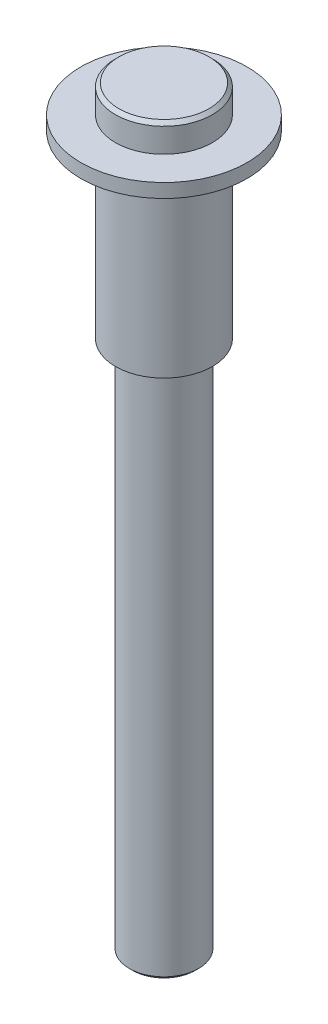
from build123d import *

# Parameters (mm, degrees)
SKETCH2_R           = 3.5
BOSS_EXTRUDE1_DEPTH = 16
CHAMFER1_SIZE       = 0.25
SKETCH3_R           = 2.5
BOSS_EXTRUDE2_DEPTH = 38.4
CHAMFER2_SIZE       = 0.25
SKETCH4_R           = 6
BOSS_EXTRUDE3_DEPTH = 1


with BuildPart() as part:
    # Sketch2 → Boss-Extrude1 (new body)
    with BuildSketch(Plane(origin=(0, 0, 0), x_dir=(1, 0, 0), z_dir=(0, 1, 0))):
        with Locations(Location((0, 0, 0), (0, 0, 270))):
            Circle(SKETCH2_R)
    extrude(amount=BOSS_EXTRUDE1_DEPTH)

    # Chamfer1
    chamfer1_edges = [part.edges().sort_by_distance(p)[0] for p in [
        (0, 16, -3.5),
    ]]
    chamfer(chamfer1_edges, length=CHAMFER1_SIZE)

    # Sketch3 → Boss-Extrude2 (add)
    with BuildSketch(Plane.XZ):
        with Locations(Location((0, 0, 0), (0, 0, 90))):
            Circle(SKETCH3_R)
    extrude(amount=BOSS_EXTRUDE2_DEPTH)

    # Chamfer2
    chamfer2_edges = [part.edges().sort_by_distance(p)[0] for p in [
        (0, -38.4, -2.5),
    ]]
    chamfer(chamfer2_edges, length=CHAMFER2_SIZE)

    # Sketch4 → Boss-Extrude3 (add)
    with BuildSketch(Plane(origin=(0, 14, 0), x_dir=(1, 0, 0), z_dir=(0, 1, 0))):
        with Locations(Location((0, 0, 0), (0, 0, 270))):
            Circle(SKETCH4_R)
    extrude(amount=-BOSS_EXTRUDE3_DEPTH)


solid = part.part
